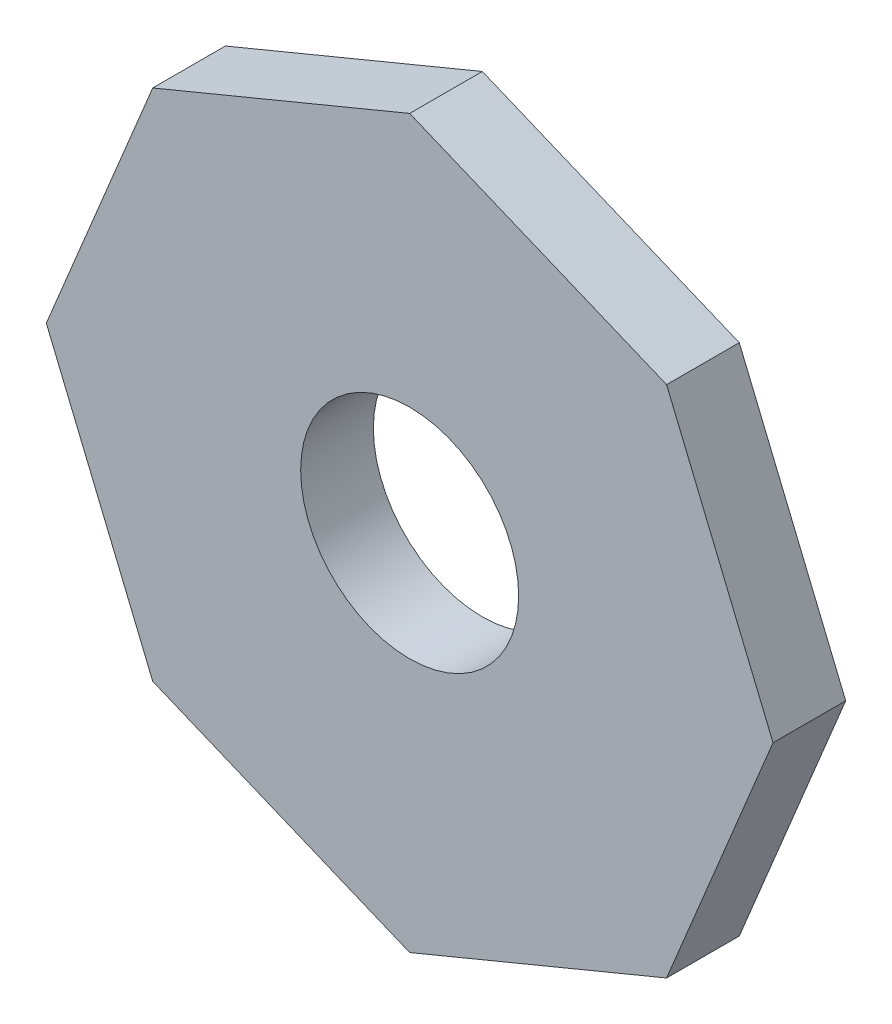
from build123d import *

# Parameters (mm, degrees)
EXTRUDE_1_DEPTH     = 20
SKETCH_2_R          = 30
CUT_EXTRUDE_2_DEPTH = 143.828568571


with BuildPart() as part:
    # 草图1 → 凸台-拉伸1 (new body)
    with BuildSketch(Plane.XY):
        Polygon((100, 0), (70.710678119, 70.710678119), (0, 100), (-70.710678119, 70.710678119), (-100, 0), (-70.710678119, -70.710678119), (0, -100), (70.710678119, -70.710678119), align=None)
    extrude(amount=EXTRUDE_1_DEPTH)

    # 草图2 → 切除-拉伸2 (cut, through all)
    with BuildSketch(Plane.XY):
        Circle(SKETCH_2_R)
    extrude(amount=CUT_EXTRUDE_2_DEPTH, mode=Mode.SUBTRACT)


solid = part.part
